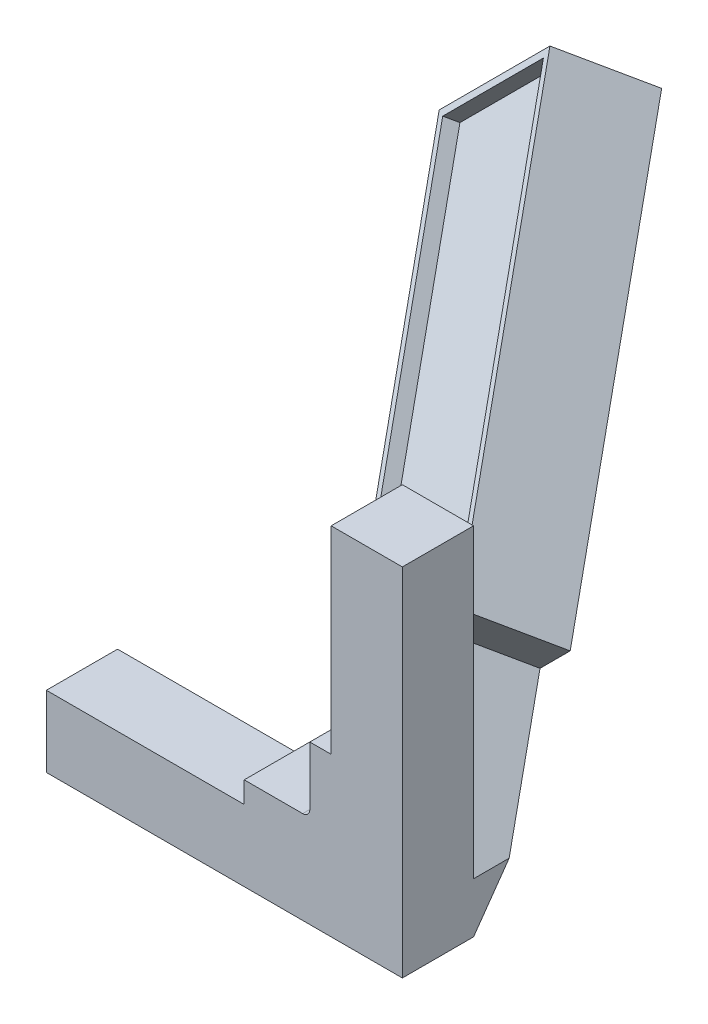
from build123d import *

# Parameters (mm, degrees)
BASE_DEPTH          = 5
ARM_DEPTH           = 5
CUT_EXTRUDE1_DEPTH  = 62.298890068
BOSS_EXTRUDE4_REACH = 56.763
FILLET2_R           = 1
BOSS_EXTRUDE5_DEPTH = 12.99811477
CUT_EXTRUDE2_DEPTH  = 2


with BuildPart() as part:
    # Sketch1 → base (new, symmetric)
    with BuildSketch(Plane.XY):
        Polygon((26.10428282, -26.10428282), (36.10428282, -36.10428282), (36.10428282, 13.89571718), (26.10428282, 13.89571718), (26.10428282, -13.89571718), (23.10616805, -13.89571718), (23.10616805, -17.35428282), (26.10428282, -17.35428282), align=None)
        Polygon((13.89571718, -26.10428282), (-13.89571718, -26.10428282), (-13.89571718, -36.10428282), (36.10428282, -36.10428282), (26.10428282, -26.10428282), (17.35428282, -26.10428282), (17.35428282, -23.10616805), (13.89571718, -23.10616805), align=None)
        Polygon((23.10616805, -23.10616805), (17.35428282, -23.10616805), (17.35428282, -26.10428282), (26.10428282, -26.10428282), align=None)
        Polygon((23.10616805, -23.10616805), (26.10428282, -26.10428282), (26.10428282, -17.35428282), (23.10616805, -17.35428282), align=None)
    extrude(amount=BASE_DEPTH, both=True)

    # Sketch2 → arm (add, symmetric)
    with BuildSketch(Plane(origin=(0, 0, 0), x_dir=(-0.7071067811865477, 0.7071067811865475, 0), z_dir=(-0.7071067811865475, -0.7071067811865477, 0))):
        Polygon((-51.059166424, 5), (-31.261509609, 24.797656814), (-22.070454513, 15.606601718), (-32.677056231, 5), align=None)
    extrude(amount=ARM_DEPTH, both=True)

    # Sketch3 → Cut-Extrude1 (cut, through all)
    with BuildSketch(Plane.XY):
        Polygon((36.10428282, -29.033215008), (36.10428282, -36.10428282), (29.033215008, -36.10428282), (32.780880948, -39.85194876), (39.85194876, -32.780880948), align=None)
    extrude(amount=-CUT_EXTRUDE1_DEPTH, mode=Mode.SUBTRACT)

    # Boss-Extrude4: up to this face of the body (flat: up to its plane)
    boss_extrude4_end = Plane(part.part.faces().sort_by_distance((19.35616805, -19.35616805, -10.303300859))[0])
    # Sketch5 → Boss-Extrude4 (add, up to the picked face)
    with BuildSketch(Plane(origin=(0, 0, -5), x_dir=(-1, 0, 0), z_dir=(0, 0, -1)), mode=Mode.PRIVATE) as boss_extrude4_sk1:
        Polygon((-26.641701956, -19.570634144), (-26.641701956, -26.641701956), (-19.570634144, -26.641701956), (-16.035100238, -23.10616805), (-23.10616805, -23.10616805), (-23.10616805, -16.035100238), align=None)
    boss_extrude4_tool1 = split(extrude(boss_extrude4_sk1.sketch, amount=BOSS_EXTRUDE4_REACH, mode=Mode.PRIVATE), bisect_by=boss_extrude4_end, keep=Keep.BOTH, mode=Mode.PRIVATE)
    add(boss_extrude4_tool1.solids().sort_by(Axis((26.491702, -23.106168, -5), (0, 0, -1)))[0])
    add(boss_extrude4_tool1.solids().sort_by(Axis((26.491702, -23.106168, -5), (0, 0, -1)))[1])

    # Fillet2
    fillet2_edges = [part.edges().sort_by_distance(p)[0] for p in [
        (23.10616805, -23.10616805, 0),
    ]]
    fillet(fillet2_edges, radius=FILLET2_R)

    # Sketch6 → Boss-Extrude5 (add)
    # profile 1 of 2: a face of its own
    with BuildSketch(Plane(origin=(13.320850978, -13.320850978, -18.838528115), x_dir=(0.8660254037844379, 0.2886751345948145, 0.4082482904638636), z_dir=(-0.5000000000000013, 0.5000000000000009, 0.707106781186546))):
        Polygon((-24.175397446, 53.241733827), (11.620319244, 2.61894581), (-6.342605537, -10.082760112), (-42.138322227, 40.540027905), align=None)
        Polygon((10.226472394, 2.858092122), (-6.103459225, -8.688913262), (-40.744475376, 40.300881593), (-24.414543758, 51.847886977), align=None, mode=Mode.SUBTRACT)
    # profile 2 of 2: a face of its own
    with BuildSketch(Plane(origin=(13.320850978, -13.320850978, -18.838528115), x_dir=(0.8660254037844379, 0.2886751345948145, 0.4082482904638636), z_dir=(-0.5000000000000013, 0.5000000000000009, 0.707106781186546))):
        Polygon((-6.103459225, -8.688913262), (-40.744475376, 40.300881593), (-24.414543758, 51.847886977), (10.226472394, 2.858092122), align=None)
    extrude(amount=-BOSS_EXTRUDE5_DEPTH)

    # Sketch6<3> → Cut-Extrude2 (cut)
    with BuildSketch(Plane(origin=(13.320850978, -13.320850978, -18.838528115), x_dir=(0.8660254037844379, 0.2886751345948145, 0.4082482904638636), z_dir=(-0.5000000000000013, 0.5000000000000009, 0.707106781186546))):
        Polygon((-6.103459225, -8.688913262), (-40.744475376, 40.300881593), (-24.414543758, 51.847886977), (10.226472394, 2.858092122), align=None)
    extrude(amount=-CUT_EXTRUDE2_DEPTH, mode=Mode.SUBTRACT)


solid = part.part
